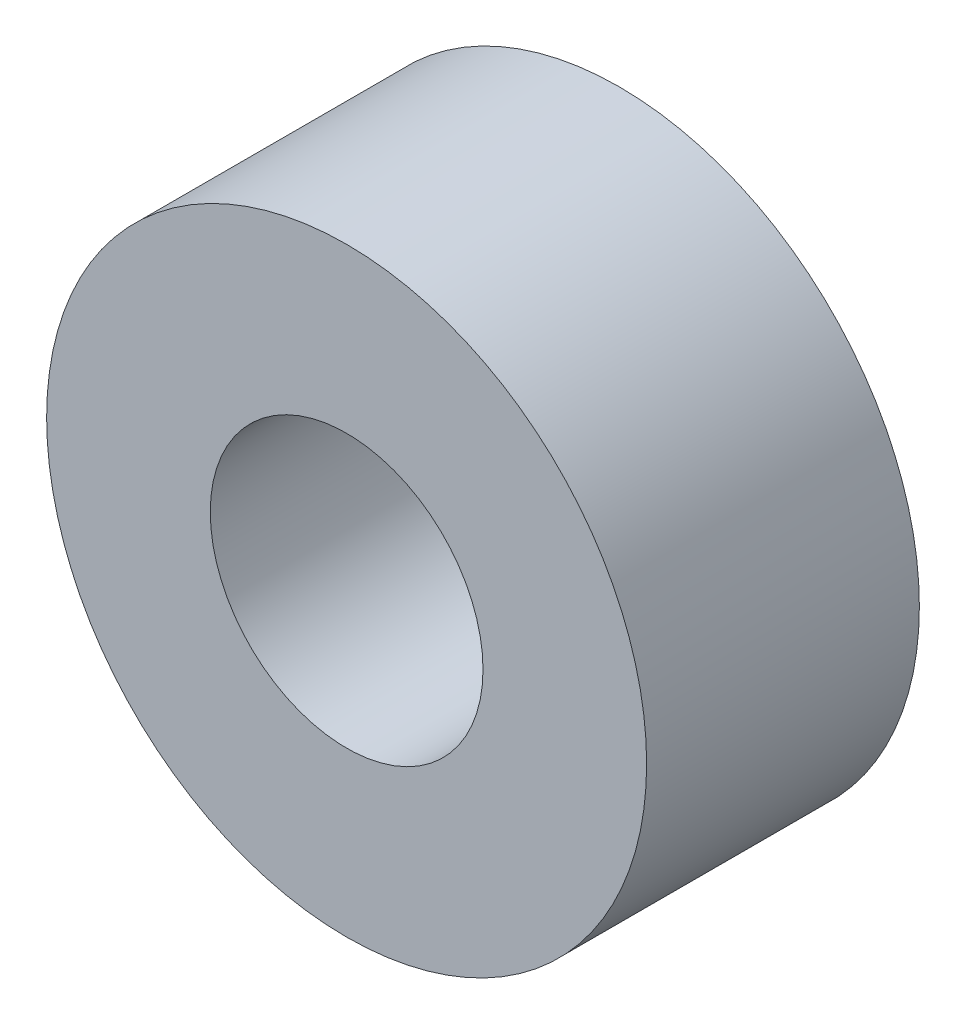
from build123d import *

# Parameters (mm, degrees)
SKETCH_1_R      = 5.5
SKETCH_1_R_2    = 2.5
EXTRUDE_1_DEPTH = 2.5


with BuildPart() as part:
    # Эскиз1 → Бобышка-Вытянуть1 (new, symmetric)
    with BuildSketch(Plane.XY):
        Circle(SKETCH_1_R)
        Circle(SKETCH_1_R_2, mode=Mode.SUBTRACT)
    extrude(amount=EXTRUDE_1_DEPTH, both=True)


solid = part.part
